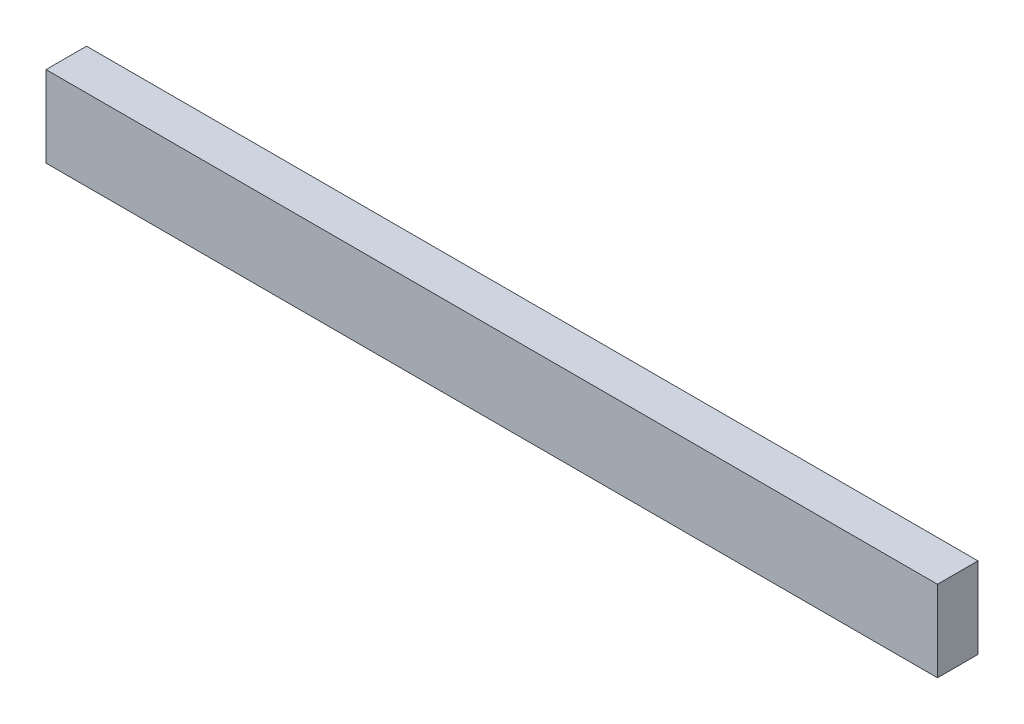
from build123d import *

# Parameters (mm, degrees)
SKETCH1_W           = 69.85
SKETCH1_H           = 6.35
BOSS_EXTRUDE1_DEPTH = 3.175


with BuildPart() as part:
    # Sketch1 → Boss-Extrude1 (new body)
    with BuildSketch(Plane.XY):
        Rectangle(SKETCH1_W, SKETCH1_H)
    extrude(amount=BOSS_EXTRUDE1_DEPTH)


solid = part.part
